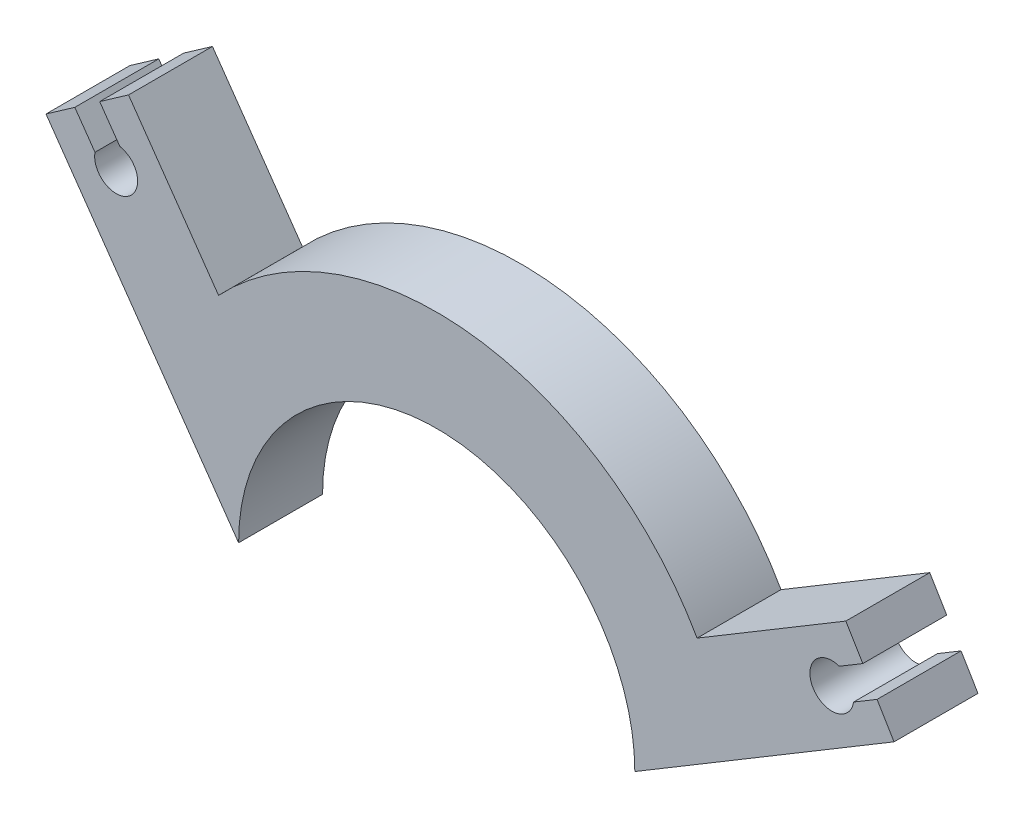
from build123d import *

# Parameters (mm, degrees)
BOSS_EXTRUDE1_DEPTH = 1.5875


with BuildPart() as part:
    # Sketch2 → Boss-Extrude1 (new body)
    with BuildSketch(Plane.XY):
        with BuildLine():
            Line((-3.7465, 0), (-7.388710371, 5.201615481))
            Line((-7.388710371, 5.201615481), (-6.843866294, 5.583119411))
            Line((-6.843866294, 5.583119411), (-6.462362364, 5.038275334))
            ThreePointArc((-6.462362364, 5.038275334), (-5.829035029, 4.634801324), (-5.991565874, 5.367930585))
            Line((-5.991565874, 5.367930585), (-6.373069804, 5.912774663))
            Line((-6.373069804, 5.912774663), (-5.828225726, 6.294278592))
            Line((-5.828225726, 6.294278592), (-4.125527549, 3.862573584))
            ThreePointArc((-4.125527549, 3.862573584), (0.674894997, 5.611057743), (4.923786313, 2.774126996))
            Line((4.923786313, 2.774126996), (7.736674427, 4.459657279))
            Line((7.736674427, 4.459657279), (8.057589571, 3.924099773))
            Line((8.057589571, 3.924099773), (7.612727117, 3.657530643))
            ThreePointArc((7.612727117, 3.657530643), (7.116813389, 3.053887496), (7.882987176, 3.206508602))
            Line((7.882987176, 3.206508602), (8.32784963, 3.473077733))
            Line((8.32784963, 3.473077733), (8.648764774, 2.937520227))
            Line((8.648764774, 2.937520227), (3.7465, 0))
            ThreePointArc((3.7465, 0), (0, 3.7465), (-3.7465, 0))
        make_face()
    extrude(amount=BOSS_EXTRUDE1_DEPTH)


solid = part.part
